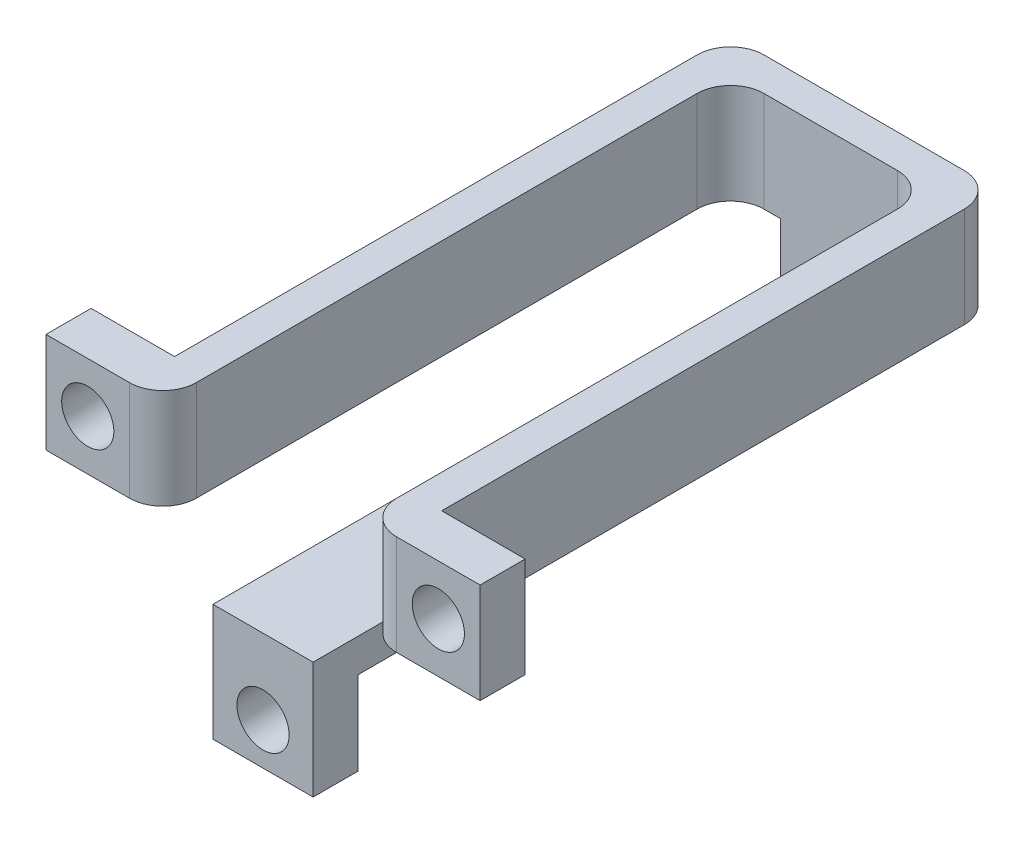
from build123d import *

# Parameters (mm, degrees)
BOSS_EXTRUDE1_DEPTH                = 76.2
SKETCH3_W                          = 34.29
SKETCH3_H                          = 76.2
BOSS_EXTRUDE2_DEPTH                = 63.5
FILLET1_R                          = 25.4
FILLET2_R                          = 25.4
F_1_3_4_5_TAPPED_HOLE1_D           = 39.6875
BOSS_EXTRUDE3_DEPTH                = 38.1
SKETCH10_W                         = 76.2
SKETCH10_H                         = 34.29
BOSS_EXTRUDE4_DEPTH                = 63.5
F_1_3_4_5_TAPPED_HOLE2_D           = 39.6875
F_1_3_4_5_TAPPED_HOLE2_CSINK_D     = 45.72
F_1_3_4_5_TAPPED_HOLE2_CSINK_ANGLE = 90


with BuildPart() as part:
    # Sketch2 → Boss-Extrude1 (new body)
    with BuildSketch(Plane(origin=(0, 0, 0), x_dir=(1, 0, 0), z_dir=(0, 1, 0))):
        Polygon((-101.6, -215.9), (-101.6, 241.3), (101.6, 241.3), (101.6, -215.9), (76.2, -215.9), (76.2, 215.9), (-76.2, 215.9), (-76.2, -215.9), align=None)
    extrude(amount=BOSS_EXTRUDE1_DEPTH)

    # Sketch3 → Boss-Extrude2 (add)
    with BuildSketch(Plane(origin=(101.6, 0, 0), x_dir=(0, 0, -1), z_dir=(1, 0, 0))):
        with Locations((-198.755, 38.1)):
            Rectangle(SKETCH3_W, SKETCH3_H)
    boss_extrude2 = extrude(amount=BOSS_EXTRUDE2_DEPTH)

    # Mirror1: Boss-Extrude2 across plane
    add(boss_extrude2.mirror(Plane(origin=(0, 0, 0), x_dir=(0, 0, 1), z_dir=(1, 0, 0))))

    # Fillet1
    fillet1_edges = [part.edges().sort_by_distance(p)[0] for p in [
        (-76.2, 38.1, 215.9),
        (-101.6, 38.1, -241.3),
        (101.6, 38.1, -241.3),
        (76.2, 38.1, 215.9),
    ]]
    fillet(fillet1_edges, radius=FILLET1_R)

    # Fillet2
    fillet2_edges = [part.edges().sort_by_distance(p)[0] for p in [
        (76.2, 38.1, -215.9),
        (-76.2, 38.1, -215.9),
    ]]
    fillet(fillet2_edges, radius=FILLET2_R)

    # 1-3/4-5 Tapped Hole1 (through all)
    with Locations(Plane(origin=(0, 0, 181.61), x_dir=(-1, 0, 0), z_dir=(0, 0, -1))):
        with Locations((-133.35, 38.1)):
            f_1_3_4_5_tapped_hole1 = Hole(F_1_3_4_5_TAPPED_HOLE1_D / 2)

    # Mirror2: 1-3/4-5 Tapped Hole1 across plane
    add(f_1_3_4_5_tapped_hole1.mirror(Plane(origin=(0, 0, 0), x_dir=(0, 0, 1), z_dir=(1, 0, 0))), mode=Mode.SUBTRACT)

    # Sketch9 → Boss-Extrude3 (add, symmetric)
    with BuildSketch(Plane(origin=(0, 0, 0), x_dir=(0, 0, -1), z_dir=(1, 0, 0))):
        Polygon((-215.9, -63.5), (241.3, -63.5), (241.3, 38.1), (215.9, 38.1), (215.9, -38.1), (-215.9, -38.1), align=None)
    extrude(amount=BOSS_EXTRUDE3_DEPTH, both=True)

    # Sketch10 → Boss-Extrude4 (add)
    with BuildSketch(Plane.XZ.offset(63.5)):
        with Locations((0, 198.755)):
            Rectangle(SKETCH10_W, SKETCH10_H)
    extrude(amount=BOSS_EXTRUDE4_DEPTH)

    # 1-3/4-5 Tapped Hole2 (through all)
    with Locations(Plane(origin=(0, 0, 181.61), x_dir=(-1, 0, 0), z_dir=(0, 0, -1))):
        with Locations((0, -95.221260733)):
            CounterSinkHole(F_1_3_4_5_TAPPED_HOLE2_D / 2, F_1_3_4_5_TAPPED_HOLE2_CSINK_D / 2, counter_sink_angle=F_1_3_4_5_TAPPED_HOLE2_CSINK_ANGLE)


solid = part.part
